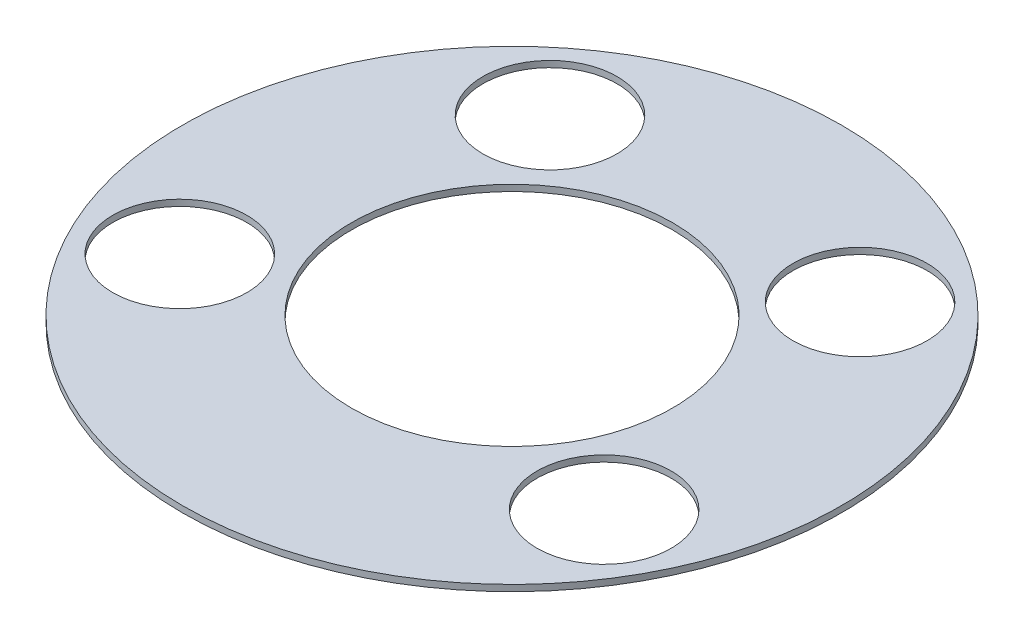
from build123d import *

# Parameters (mm, degrees)
SKETCH1_R           = 52.338
SKETCH1_R_2         = 25.506
SKETCH1_R_3         = 10.65
BOSS_EXTRUDE2_DEPTH = 1


with BuildPart() as part:
    # Sketch1 → Boss-Extrude2 (new body)
    with BuildSketch(Plane(origin=(0, 0, 0), x_dir=(1, 0, 0), z_dir=(0, 1, 0))):
        with Locations(Location((-9.27910221, -5.857415623, 0), (0, 0, 270))):
            Circle(SKETCH1_R)
        with Locations(Location((-9.27910221, -5.857415623, 0), (0, 0, 270))):
            Circle(SKETCH1_R_2, mode=Mode.SUBTRACT)
        with Locations(Location((-33.799930519, 24.690490411, 0), (0, 0, 270))):
            Circle(SKETCH1_R_3, mode=Mode.SUBTRACT)
        with Locations(Location((16.524094464, 23.615294218, 0), (0, 0, 270))):
            Circle(SKETCH1_R_3, mode=Mode.SUBTRACT)
        with Locations(Location((-44.108109072, -23.784653698, 0), (0, 0, 270))):
            Circle(SKETCH1_R_3, mode=Mode.SUBTRACT)
        with Locations(Location((24.752423429, -25.255890992, 0), (0, 0, 270))):
            Circle(SKETCH1_R_3, mode=Mode.SUBTRACT)
    extrude(amount=BOSS_EXTRUDE2_DEPTH)


solid = part.part
